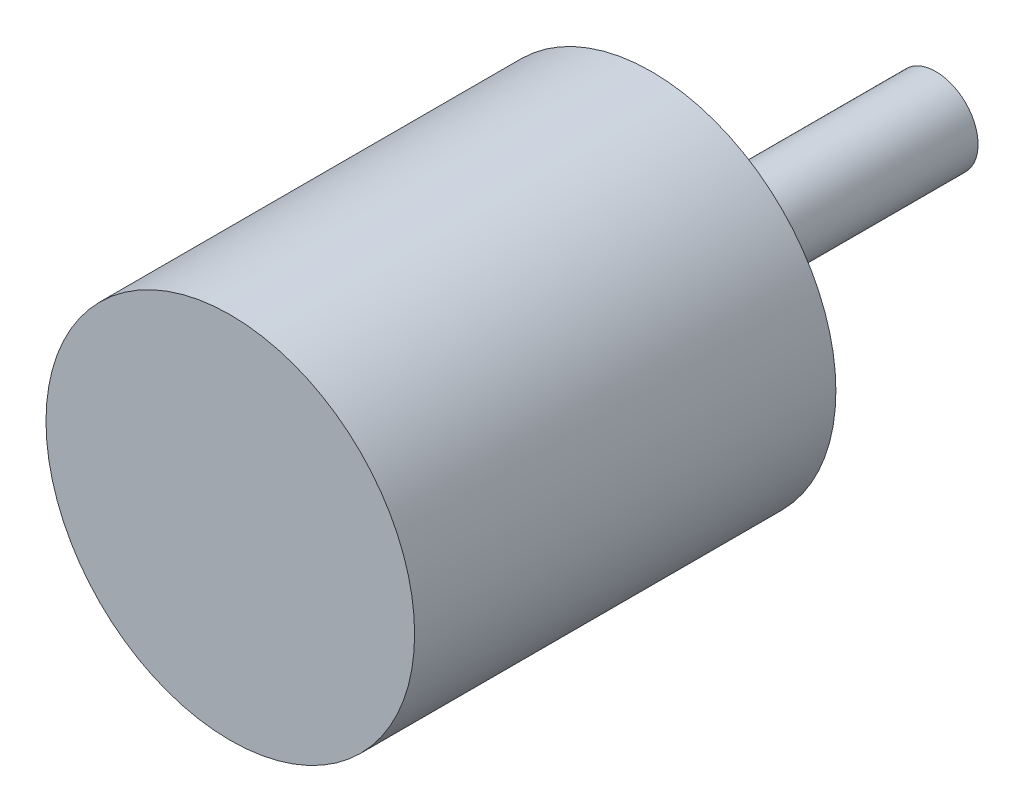
from build123d import *

# Parameters (mm, degrees)
SKETCH1_R                = 17.5
BOSS_EXTRUDE1_DEPTH      = 40
SKETCH2_R                = 2
BOSS_EXTRUDE2_DEPTH      = 17
BOSS_EXTRUDE3_DEPTH      = 10
BOSS_EXTRUDE3_DEPTH_BACK = 10
SKETCH3_R                = 4


with BuildPart() as part:
    # Sketch1 → Boss-Extrude1 (new body)
    with BuildSketch(Plane.XY):
        Circle(SKETCH1_R)
    extrude(amount=BOSS_EXTRUDE1_DEPTH)

    # Sketch2 → Boss-Extrude2 (add)
    with BuildSketch(Plane(origin=(0, 0, 0), x_dir=(-1, 0, 0), z_dir=(0, 0, -1))):
        with Locations(Location((0, 0, 0), (0, 0, 180))):
            Circle(SKETCH2_R)
    extrude(amount=BOSS_EXTRUDE2_DEPTH)

    # Sketch3 → Boss-Extrude3 (add, two sides: drawn at the far end of the back side and taken through both)
    with BuildSketch(Plane(origin=(0, 0, -17), x_dir=(-1, 0, 0), z_dir=(0, 0, -1)).offset(-BOSS_EXTRUDE3_DEPTH_BACK)):
        Circle(SKETCH3_R)
    extrude(amount=BOSS_EXTRUDE3_DEPTH + BOSS_EXTRUDE3_DEPTH_BACK)


solid = part.part
